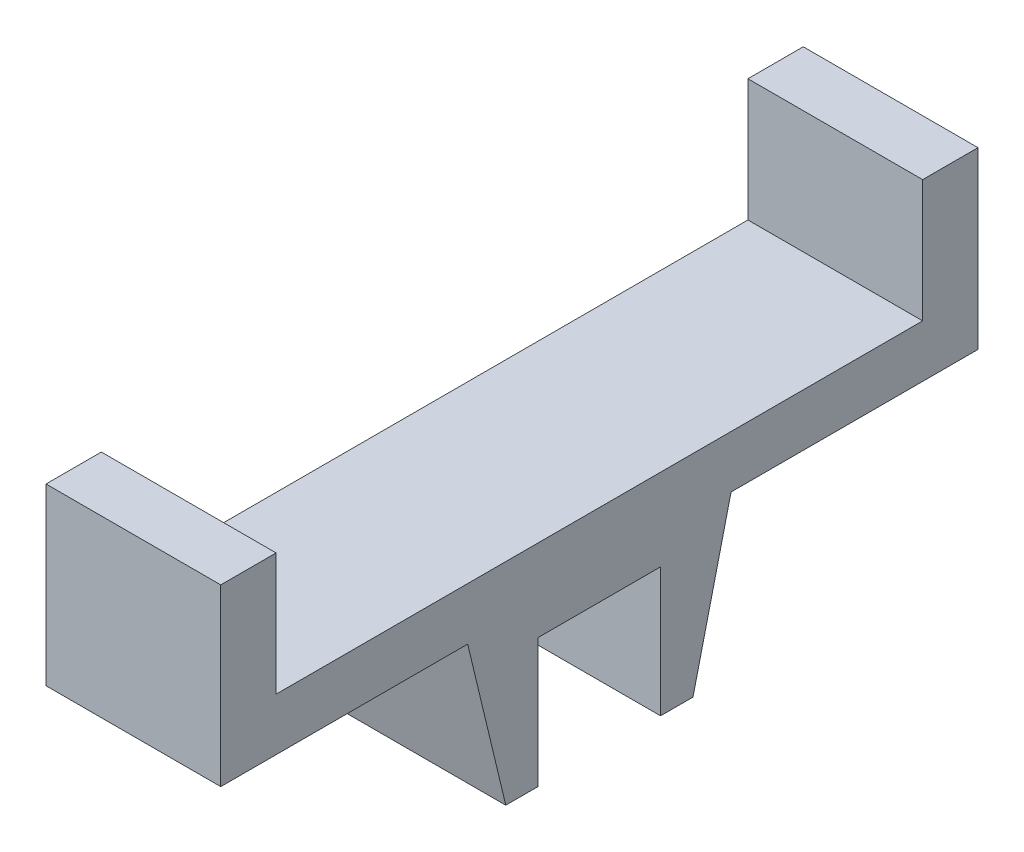
from build123d import *

# Parameters (mm, degrees)
SKETCH_2_W          = 15
SKETCH_2_H          = 65
EXTRUDE_1_DEPTH     = 15
SKETCH_7_W          = 55.5
SKETCH_7_H          = 10.5
CUT_EXTRUDE_3_DEPTH = 65.688840837
EXTRUDE_3_DEPTH     = 15


with BuildPart() as part:
    # 草图2 → 凸台-拉伸1 (new body)
    with BuildSketch(Plane(origin=(0, 0, 0), x_dir=(1, 0, 0), z_dir=(0, 1, 0))):
        with Locations((18.047235023, 28.611751152)):
            Rectangle(SKETCH_2_W, SKETCH_2_H)
    extrude(amount=EXTRUDE_1_DEPTH)

    # 草图7 → 切除-拉伸3 (cut, through all)
    with BuildSketch(Plane.ZY.offset(-10.547235023)):
        with Locations((-28.611751152, 9.75)):
            Rectangle(SKETCH_7_W, SKETCH_7_H)
    extrude(amount=-CUT_EXTRUDE_3_DEPTH, mode=Mode.SUBTRACT)

    # 草图8 → 凸台-拉伸3 (add)
    with BuildSketch(Plane.ZY.offset(-10.547235023)):
        Polygon((-17.306751152, 0), (-20.576849127, -13.612731513), (-23.361849127, -13.612731513), (-23.361849127, -2.537373778), (-33.861849127, -2.537373778), (-33.861849127, -13.612731513), (-36.646751152, -13.612731513), (-39.916849127, 0), align=None)
    extrude(amount=-EXTRUDE_3_DEPTH)


solid = part.part
